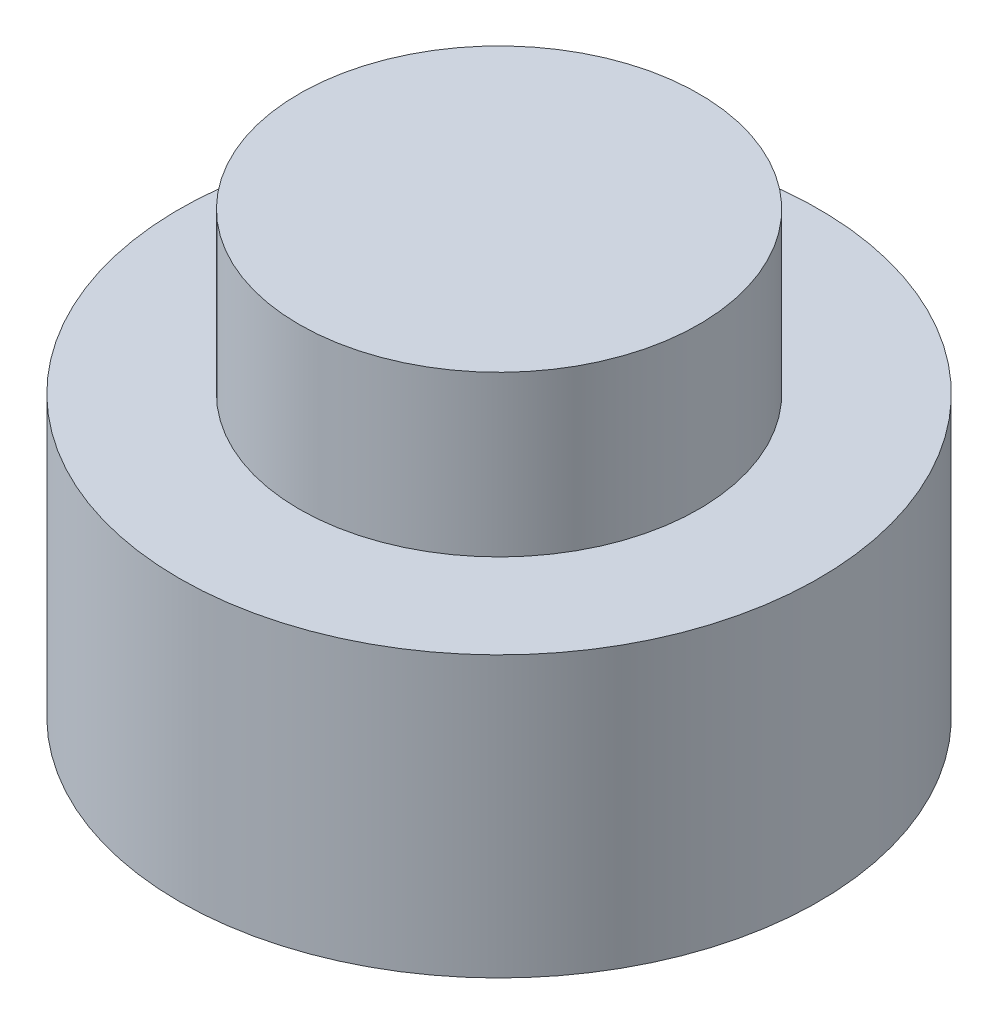
from build123d import *

# Parameters (mm, degrees)
SKETCH_1_R      = 8
EXTRUDE_1_DEPTH = 7
SKETCH_2_R      = 5
EXTRUDE_2_DEPTH = 4


with BuildPart() as part:
    # 草图1 → 凸台-拉伸1 (new body)
    with BuildSketch(Plane(origin=(0, 0, 0), x_dir=(1, 0, 0), z_dir=(0, 1, 0))):
        with Locations(Location((0, 0, 0), (0, 0, 270))):
            Circle(SKETCH_1_R)
    extrude(amount=EXTRUDE_1_DEPTH)

    # 草图2 → 凸台-拉伸2 (add)
    with BuildSketch(Plane(origin=(0, 7, 0), x_dir=(1, 0, 0), z_dir=(0, 1, 0))):
        with Locations(Location((0, 0, 0), (0, 0, 270))):
            Circle(SKETCH_2_R)
    extrude(amount=EXTRUDE_2_DEPTH)


solid = part.part
